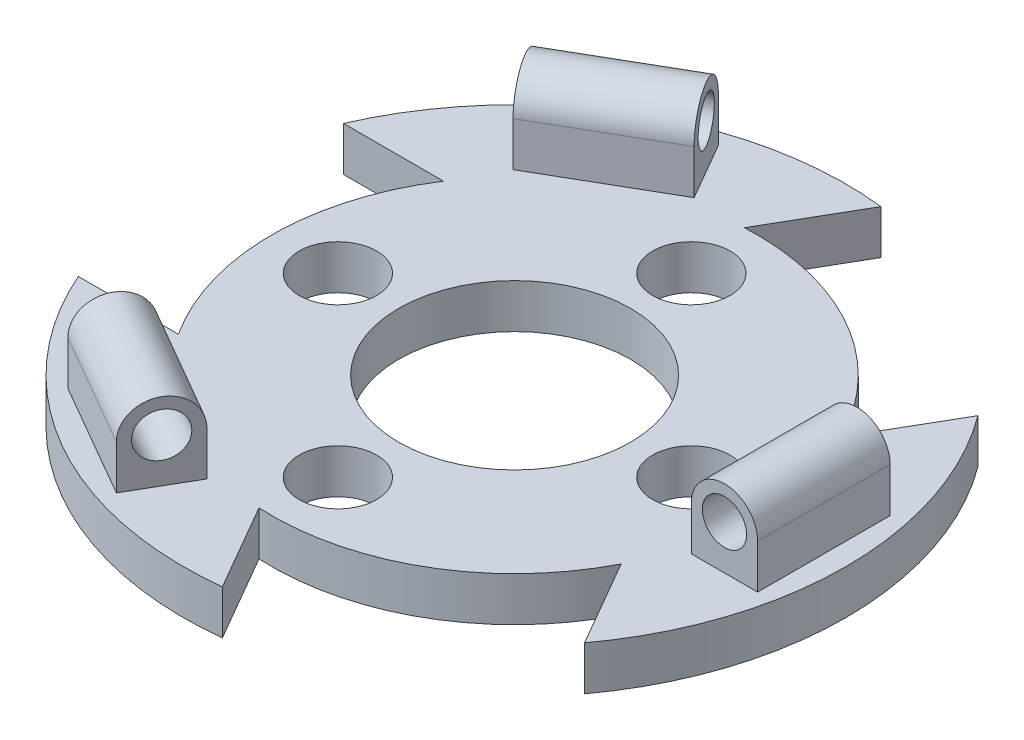
from build123d import *

# Parameters (mm, degrees)
SKETCH1_R           = 15
SKETCH1_R_2         = 5.25
SKETCH1_R_3         = 1.75
BOSS_EXTRUDE1_DEPTH = 2
SKETCH2_R           = 1
BOSS_EXTRUDE2_DEPTH = 3
CIRPATTERN1_COUNT   = 3
SKETCH3_OUTSIDE_W   = 40.556
SKETCH3_OUTSIDE_H   = 40.556
CUT_EXTRUDE1_DEPTH  = 10


with BuildPart() as part:
    # Sketch1 → Boss-Extrude1 (new body)
    with BuildSketch(Plane(origin=(0, 0, 0), x_dir=(1, 0, 0), z_dir=(0, 1, 0))):
        with Locations(Location((0, 0, 0), (0, 0, 270))):
            Circle(SKETCH1_R)
        with Locations(Location((0, 0, 0), (0, 0, 270))):
            Circle(SKETCH1_R_2, mode=Mode.SUBTRACT)
        with Locations(Location((0, 8, 0), (0, 0, 270))):
            Circle(SKETCH1_R_3, mode=Mode.SUBTRACT)
        with Locations(Location((8, 0, 0), (0, 0, 270))):
            Circle(SKETCH1_R_3, mode=Mode.SUBTRACT)
        with Locations(Location((0, -8, 0), (0, 0, 270))):
            Circle(SKETCH1_R_3, mode=Mode.SUBTRACT)
        with Locations(Location((-8, 0, 0), (0, 0, 270))):
            Circle(SKETCH1_R_3, mode=Mode.SUBTRACT)
    extrude(amount=BOSS_EXTRUDE1_DEPTH)

    # Sketch2 → Boss-Extrude2 (add, symmetric)
    with BuildSketch(Plane.XY):
        with BuildLine():
            Line((11, 2), (11, 4))
            ThreePointArc((11, 4), (12.5, 5.5), (14, 4))
            Line((14, 4), (14, 2))
            Line((14, 2), (11, 2))
        make_face()
        with Locations((12.5, 4)):
            Circle(SKETCH2_R, mode=Mode.SUBTRACT)
    boss_extrude2 = extrude(amount=BOSS_EXTRUDE2_DEPTH, both=True)

    # CirPattern1: Boss-Extrude2 ×3 about axis
    cirpattern1_axis = Axis((0, 0, 0), (0, 1, 0))
    for i in range(1, CIRPATTERN1_COUNT):
        add(boss_extrude2.rotate(cirpattern1_axis, i * 360 / CIRPATTERN1_COUNT))

    # Sketch3 outside → Cut-Extrude1 (cut)
    with BuildSketch(Plane(origin=(0, 2, 0), x_dir=(1, 0, 0), z_dir=(0, 1, 0))):
        Rectangle(SKETCH3_OUTSIDE_W, SKETCH3_OUTSIDE_H)
        with BuildLine():
            Line((1.67771112, -14.9058809), (-0.586380194, -10.984359711))
            ThreePointArc((-0.586380194, -10.984359711), (5.5, -9.526279442), (9.805924651, -4.984359711))
            Line((9.805924651, -4.984359711), (12.070015965, -8.9058809))
            ThreePointArc((12.070015965, -8.9058809), (15, 0), (12.070015965, 8.9058809))
            Line((12.070015965, 8.9058809), (9.805924651, 4.984359711))
            ThreePointArc((9.805924651, 4.984359711), (5.5, 9.526279442), (-0.586380194, 10.984359711))
            Line((-0.586380194, 10.984359711), (1.67771112, 14.9058809))
            ThreePointArc((1.67771112, 14.9058809), (-7.5, 12.990381057), (-13.747727085, 6))
            Line((-13.747727085, 6), (-9.219544457, 6))
            ThreePointArc((-9.219544457, 6), (-11, 0), (-9.219544457, -6))
            Line((-9.219544457, -6), (-13.747727085, -6))
            ThreePointArc((-13.747727085, -6), (-7.5, -12.990381057), (1.67771112, -14.9058809))
        make_face(mode=Mode.SUBTRACT)
    extrude(amount=-CUT_EXTRUDE1_DEPTH, mode=Mode.SUBTRACT)


solid = part.part
